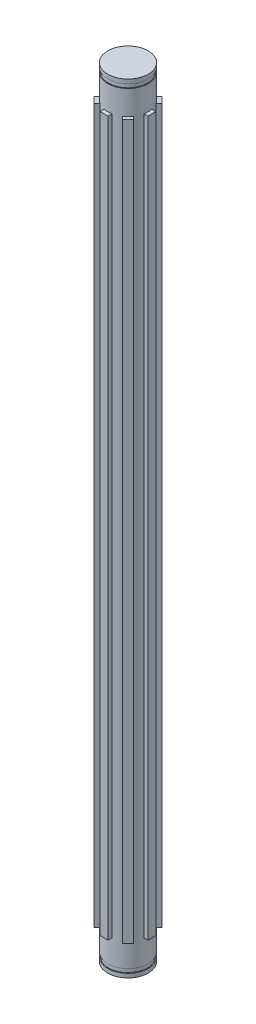
from build123d import *

# Parameters (mm, degrees)
BOSS_EXTRUDE2_START = -8
BOSS_EXTRUDE2_DEPTH = 88
CIRPATTERN1_COUNT   = 8


with BuildPart() as part:
    # Sketch3 → Revolve1 (revolve)
    with BuildSketch(Plane(origin=(0, 0, 0), x_dir=(0, 0, -1), z_dir=(1, 0, 0))):
        Polygon((5, 96), (0, 96), (0, 0), (5, 0), (5, 1), (4.8, 1), (4.8, 2), (5, 2), align=None)
    revolve(axis=Axis((0, 0, 0), (0, 1, 0)))

    # Sketch4 → Boss-Extrude2 (add, through all)
    with BuildSketch(Plane.XZ.offset(BOSS_EXTRUDE2_START)):
        with BuildLine():
            Line((-1, 5.898979486), (-1, 4.898979486))
            ThreePointArc((-1, 4.898979486), (-0.50254481, 4.974680765), (0, 5))
            Line((0, 5), (0, 5.898979486))
            Line((0, 5.898979486), (-1, 5.898979486))
        make_face()
        with BuildLine():
            Line((0, 5.898979486), (0, 5))
            ThreePointArc((0, 5), (0.50254481, 4.974680765), (1, 4.898979486))
            Line((1, 4.898979486), (1, 5.898979486))
            Line((1, 5.898979486), (0, 5.898979486))
        make_face()
    boss_extrude2 = extrude(amount=-BOSS_EXTRUDE2_DEPTH)

    # CirPattern1: Boss-Extrude2 ×8 about axis
    cirpattern1_axis = Axis((0, 0, 0), (0, 1, 0))
    for i in range(1, CIRPATTERN1_COUNT):
        add(boss_extrude2.rotate(cirpattern1_axis, i * 360 / CIRPATTERN1_COUNT))

    # Mirror1: part across plane


with BuildPart() as part_1:
    add(part.part)
    add(part.part.mirror(Plane(origin=(0, 96, 0), x_dir=(0, 0, 1), z_dir=(0, -1, 0))))


solid = part_1.part
